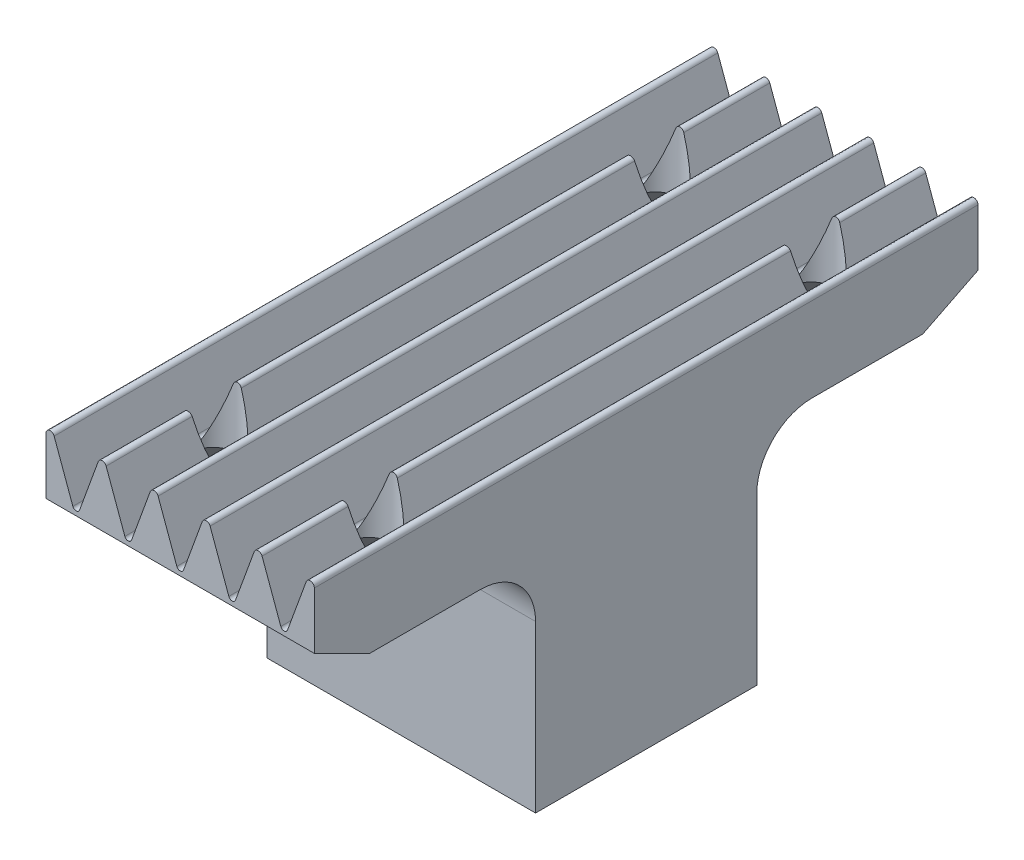
from build123d import *

# Parameters (mm, degrees)
EXTRUDE_1_DEPTH             = 60
HOLE_WIZARD_M41_D           = 4.5
HOLE_WIZARD_M41_CSINK_D     = 9.4
HOLE_WIZARD_M41_CSINK_ANGLE = 90
EXTRUDE_2_DEPTH             = 24.26
CHAMFER_1_SIZE              = 2.5
CHAMFER_1_SIZE2             = 5
CHAMFER_2_SIZE              = 5
CHAMFER_2_SIZE2             = 2.5


with BuildPart() as part:
    # Эскиз1 → Бобышка-Вытянуть1 (new body)
    with BuildSketch(Plane.XY):
        with BuildLine():
            Line((0.737083196, 7.749967654), (2.429298361, 3.100644699))
            ThreePointArc((2.429298361, 3.100644699), (2.73, 2.890091144), (3.030701639, 3.100644699))
            Line((3.030701639, 3.100644699), (4.722916804, 7.749967654))
            ThreePointArc((4.722916804, 7.749967654), (5.08, 8), (5.437083196, 7.749967654))
            Line((5.437083196, 7.749967654), (7.129298361, 3.100644699))
            ThreePointArc((7.129298361, 3.100644699), (7.43, 2.890091144), (7.730701639, 3.100644699))
            Line((7.730701639, 3.100644699), (9.422916804, 7.749967654))
            ThreePointArc((9.422916804, 7.749967654), (9.78, 8), (10.137083196, 7.749967654))
            Line((10.137083196, 7.749967654), (11.829298361, 3.100644699))
            ThreePointArc((11.829298361, 3.100644699), (12.13, 2.890091144), (12.430701639, 3.100644699))
            Line((12.430701639, 3.100644699), (14.122916804, 7.749967654))
            ThreePointArc((14.122916804, 7.749967654), (14.48, 8), (14.837083196, 7.749967654))
            Line((14.837083196, 7.749967654), (16.529298361, 3.100644699))
            ThreePointArc((16.529298361, 3.100644699), (16.83, 2.890091144), (17.130701639, 3.100644699))
            Line((17.130701639, 3.100644699), (18.822916804, 7.749967654))
            ThreePointArc((18.822916804, 7.749967654), (19.18, 8), (19.537083196, 7.749967654))
            Line((19.537083196, 7.749967654), (21.229298361, 3.100644699))
            ThreePointArc((21.229298361, 3.100644699), (21.53, 2.890091144), (21.830701639, 3.100644699))
            Line((21.830701639, 3.100644699), (23.522916804, 7.749967654))
            ThreePointArc((23.522916804, 7.749967654), (23.945986308, 7.994226946), (24.26, 7.62))
            Line((24.26, 7.62), (24.26, 0))
            Line((24.26, 0), (0, 0))
            Line((0, 0), (0, 7.62))
            ThreePointArc((0, 7.62), (0.314013692, 7.994226946), (0.737083196, 7.749967654))
        make_face()
    extrude(amount=EXTRUDE_1_DEPTH)

    # Зенковка для  винта с плоской головкой M41 (through all)
    with Locations(Plane(origin=(5.08, 0, 50), x_dir=(0, 0, -1), z_dir=(0, -1, 0))):
        with Locations((0, 0), (0, 14.1), (40, 14.1), (40, 0)):
            CounterSinkHole(HOLE_WIZARD_M41_D / 2, HOLE_WIZARD_M41_CSINK_D / 2, counter_sink_angle=HOLE_WIZARD_M41_CSINK_ANGLE)

    # Эскиз6 → Бобышка-Вытянуть2 (add, through all)
    with BuildSketch(Plane.ZY):
        with BuildLine():
            Line((40, -5), (40, -20))
            Line((40, -20), (20, -20))
            Line((20, -20), (20, -5))
            ThreePointArc((20, -5), (18.535533906, -1.464466094), (15, 0))
            Line((15, 0), (45, 0))
            ThreePointArc((45, 0), (41.464466094, -1.464466094), (40, -5))
        make_face()
    extrude(amount=-EXTRUDE_2_DEPTH)

    # Фаска1
    chamfer_1_edges = [part.edges().sort_by_distance(p)[0] for p in [
        (12.13, 0, 0),
    ]]
    chamfer_1_side = [part.faces().sort_by_distance(p)[0] for p in [
        (1.343146193, 5.337937092, 0),
    ]]
    chamfer(chamfer_1_edges, length=CHAMFER_1_SIZE, length2=CHAMFER_1_SIZE2, reference=chamfer_1_side[0])

    # Фаска2
    chamfer_2_edges = [part.edges().sort_by_distance(p)[0] for p in [
        (12.13, 0, 60),
    ]]
    chamfer_2_side = [part.faces().sort_by_distance(p)[0] for p in [
        (12.13, 0, 54.04145744),
    ]]
    chamfer(chamfer_2_edges, length=CHAMFER_2_SIZE, length2=CHAMFER_2_SIZE2, reference=chamfer_2_side[0])


solid = part.part
